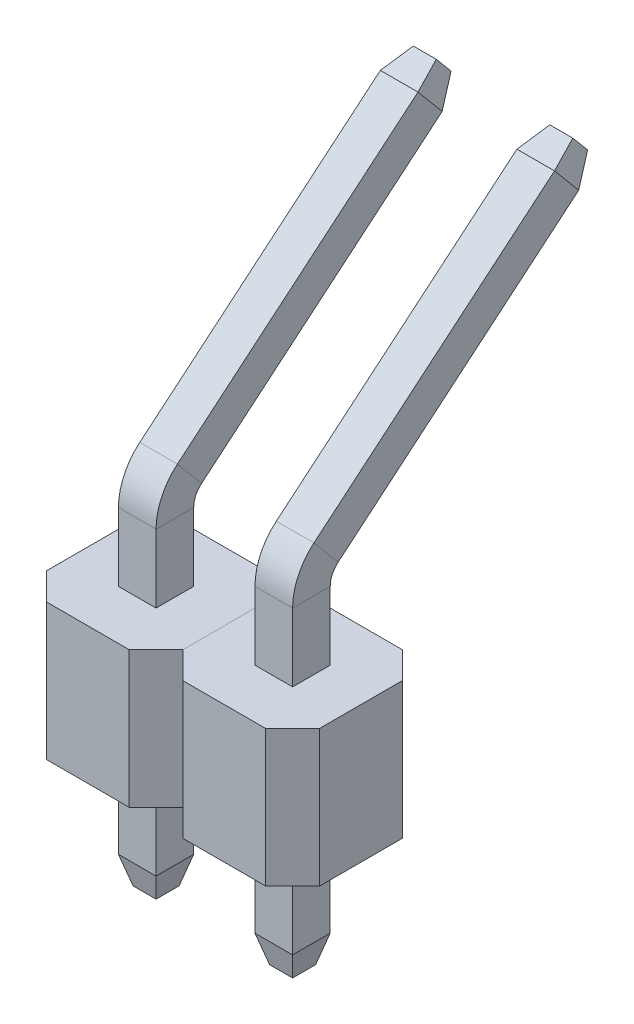
from build123d import *

# Parameters (mm, degrees)
SKETCH3_W           = 2.54
SKETCH3_H           = 2.54
SKETCH3_W_2         = 0.635
SKETCH3_H_2         = 0.635
BOSS_EXTRUDE1_DEPTH = 1.27
CHAMFER1_SIZE       = 0.5
SKETCH5_W           = 0.7
SKETCH5_H           = 0.7
SKETCH10_W          = 0.7
SKETCH10_H          = 0.7
BOSS_EXTRUDE5_DEPTH = 0.508
BOSS_EXTRUDE5_TAPER = 15
SKETCH11_W          = 0.7
SKETCH11_H          = 0.7
BOSS_EXTRUDE6_DEPTH = 0.508
BOSS_EXTRUDE6_TAPER = 15
LPATTERN1_COUNT     = 2
LPATTERN1_PITCH     = 2.54


with BuildPart() as part:
    # Sketch3 → Boss-Extrude1 (new, symmetric)
    with BuildSketch(Plane(origin=(0, 0, 0), x_dir=(1, 0, 0), z_dir=(0, 1, 0))):
        Rectangle(SKETCH3_W, SKETCH3_H)
        Rectangle(SKETCH3_W_2, SKETCH3_H_2, mode=Mode.SUBTRACT)
    extrude(amount=BOSS_EXTRUDE1_DEPTH, both=True)

    # Chamfer1
    chamfer1_edges = [part.edges().sort_by_distance(p)[0] for p in [
        (1.27, 0, 1.27),
        (-1.27, 0, 1.27),
        (-1.27, 0, -1.27),
        (1.27, 0, -1.27),
    ]]
    chamfer(chamfer1_edges, length=CHAMFER1_SIZE)


with BuildPart() as body_2:
    # Sweep1: sweep along a path in Sketch9
    with BuildLine(Plane(origin=(0, 0, 0), x_dir=(0, 0, -1), z_dir=(1, 0, 0))) as sweep1_path:
        Line((0, -3.048), (0, 2.54))
        ThreePointArc((0, 2.54), (0.071393466, 2.862035115), (0.272195841, 3.123725866))
        Line((0.272195841, 3.123725866), (4.747427478, 6.878891081))
    # Sketch5 → Sweep1 (sweep)
    with BuildSketch(Plane(origin=(0, 1.27, 0), x_dir=(1, 0, 0), z_dir=(0, 1, 0))):
        Rectangle(SKETCH5_W, SKETCH5_H)
    sweep(path=sweep1_path.line)

    # Sketch10 → Boss-Extrude5 (add)
    with BuildSketch(Plane(origin=(0, 5.179843784, -6.173097439), x_dir=(1, 0, 0), z_dir=(0, 0.6427876096865378, -0.7660444431189793))):
        with Locations((0, -2.217948727)):
            Rectangle(SKETCH10_W, SKETCH10_H)
    extrude(amount=BOSS_EXTRUDE5_DEPTH, taper=BOSS_EXTRUDE5_TAPER)

    # Sketch11 → Boss-Extrude6 (add)
    with BuildSketch(Plane.XZ.offset(3.048)):
        Rectangle(SKETCH11_W, SKETCH11_H)
    extrude(amount=BOSS_EXTRUDE6_DEPTH, taper=BOSS_EXTRUDE6_TAPER)


with BuildPart() as lpattern1_1:
    # LPattern1: pattern copy
    add(part.part.moved(Location(Vector(1, 0, 0) * (1 * LPATTERN1_PITCH))))


with BuildPart() as lpattern1_2:
    # LPattern1: pattern copy
    add(body_2.part.moved(Location(Vector(1, 0, 0) * (1 * LPATTERN1_PITCH))))


solid = Compound([part.part, body_2.part, lpattern1_1.part, lpattern1_2.part])
